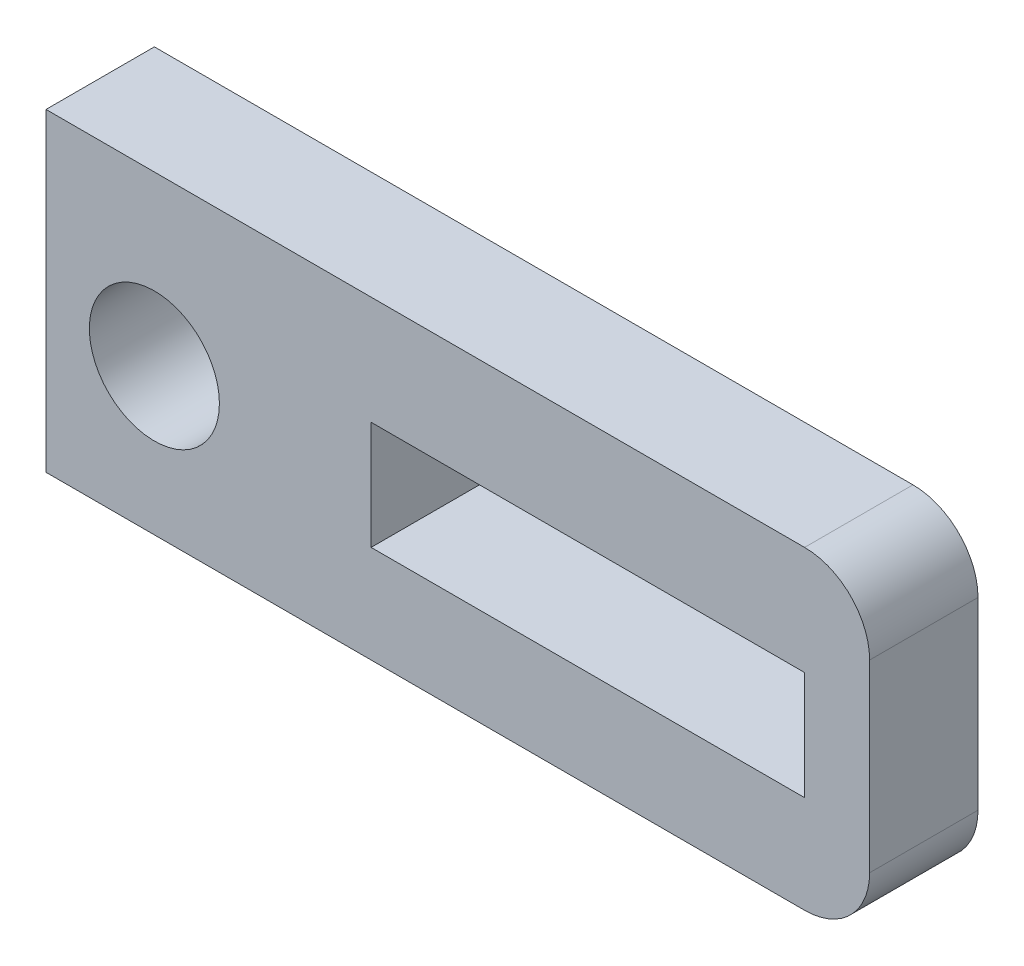
from build123d import *

# Parameters (mm, degrees)
SKETCH1_W           = 20
SKETCH1_H           = 5
BOSS_EXTRUDE1_DEPTH = 5


with BuildPart() as part:
    # Sketch1 → Boss-Extrude1 (new body)
    with BuildSketch(Plane.XY):
        with BuildLine():
            Line((77, 15), (42, 15))
            Line((42, 15), (42, 7.25))
            Line((42, 7.25), (42, 0.5))
            Line((42, 0.5), (77, 0.5))
            ThreePointArc((77, 0.5), (79.121320344, 1.378679656), (80, 3.5))
            Line((80, 3.5), (80, 12))
            ThreePointArc((80, 12), (79.121320344, 14.121320344), (77, 15))
        make_face()
        with BuildLine():
            ThreePointArc((50, 7.25), (47, 4.25), (44, 7.25))
            ThreePointArc((44, 7.25), (47, 10.25), (50, 7.25))
        make_face(mode=Mode.SUBTRACT)
        with Locations((67, 7.5)):
            Rectangle(SKETCH1_W, SKETCH1_H, mode=Mode.SUBTRACT)
    extrude(amount=BOSS_EXTRUDE1_DEPTH)


solid = part.part
